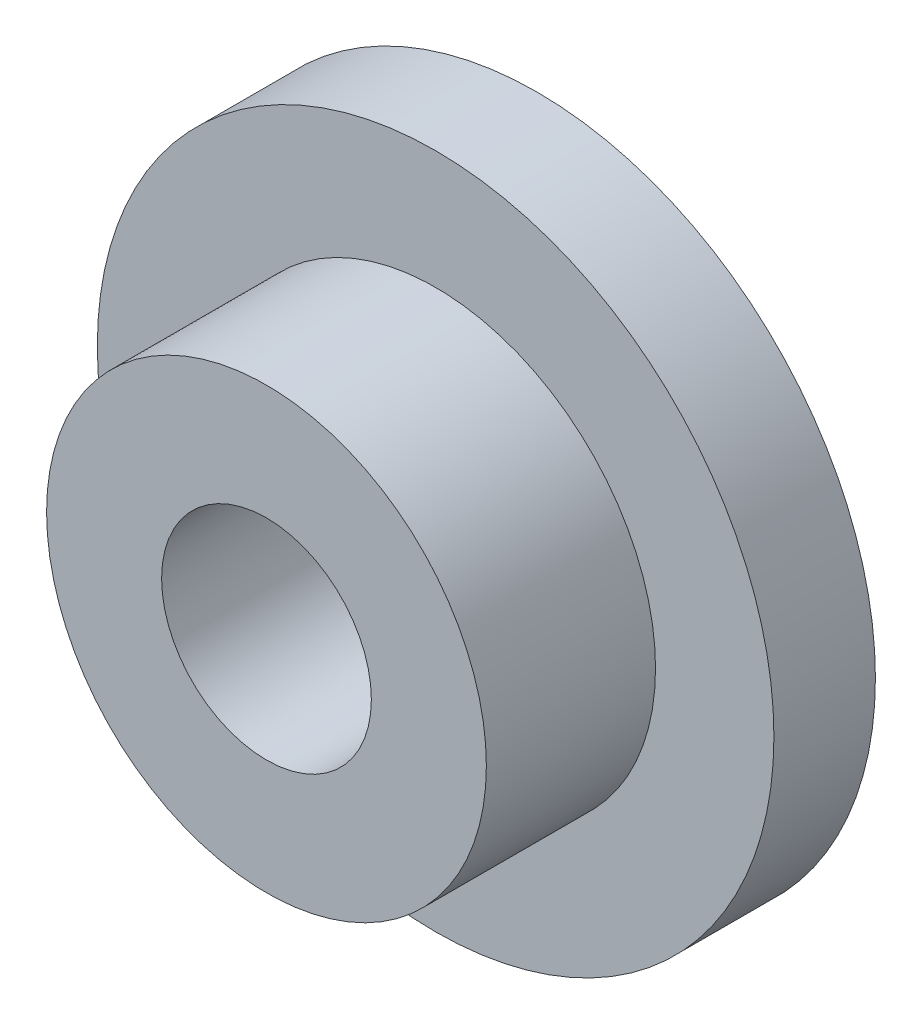
from build123d import *

# Parameters (mm, degrees)
CROQUIS1_R              = 5
CROQUIS1_R_2            = 1.55
SALIENTE_EXTRUIR1_DEPTH = 1.5
CROQUIS2_R              = 3.25
CROQUIS2_R_2            = 1.55
SALIENTE_EXTRUIR2_DEPTH = 2.5


with BuildPart() as part:
    # Croquis1 → Saliente-Extruir1 (new body)
    with BuildSketch(Plane.XY):
        Circle(CROQUIS1_R)
        Circle(CROQUIS1_R_2, mode=Mode.SUBTRACT)
    extrude(amount=SALIENTE_EXTRUIR1_DEPTH)

    # Croquis2 → Saliente-Extruir2 (add)
    with BuildSketch(Plane.XY.offset(1.5)):
        Circle(CROQUIS2_R)
        Circle(CROQUIS2_R_2, mode=Mode.SUBTRACT)
    extrude(amount=SALIENTE_EXTRUIR2_DEPTH)


solid = part.part
